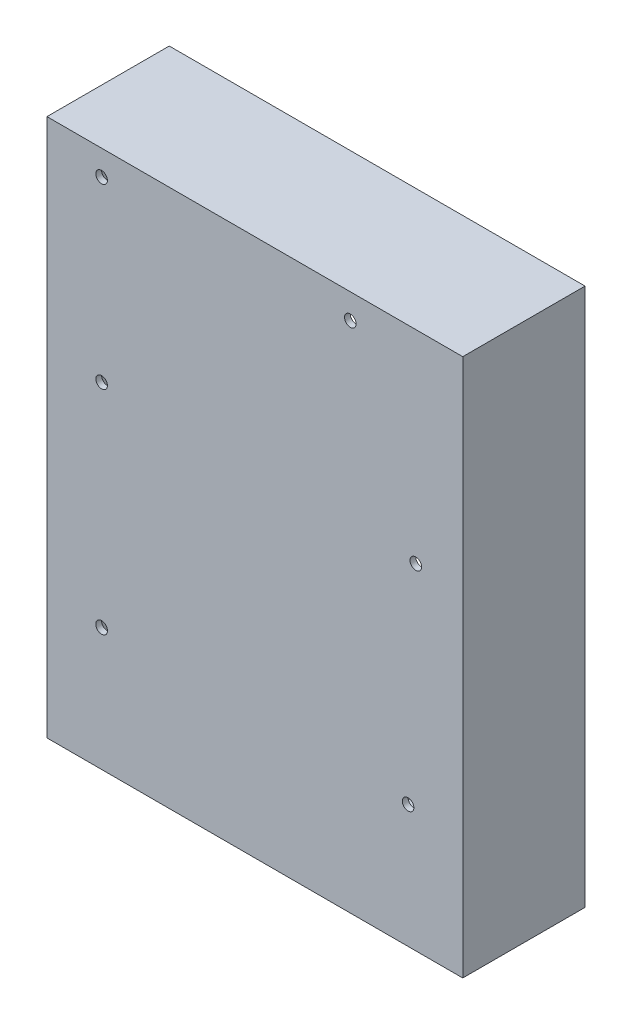
from build123d import *

# Parameters (mm, degrees)
SKETCH1_W           = 215.9
SKETCH1_H           = 279.4
BOSS_EXTRUDE1_DEPTH = 3
SKETCH2_W           = 215.9
SKETCH2_H           = 279.4
SKETCH2_W_2         = 209.9
SKETCH2_H_2         = 273.4
BOSS_EXTRUDE2_DEPTH = 63.5
SKETCH3_R           = 3
SKETCH3_R_2         = 3.05
CUT_EXTRUDE3_DEPTH  = 5


with BuildPart() as part:
    # Sketch1 → Boss-Extrude1 (new body)
    with BuildSketch(Plane.XY):
        with Locations((-11.047990366, 57.640345361)):
            Rectangle(SKETCH1_W, SKETCH1_H)
    extrude(amount=BOSS_EXTRUDE1_DEPTH)

    # Sketch2 → Boss-Extrude2 (add)
    with BuildSketch(Plane.XY.offset(3)):
        with Locations((-11.047990366, 57.640345361)):
            Rectangle(SKETCH2_W, SKETCH2_H)
        with Locations((-11.047990366, 57.640345361)):
            Rectangle(SKETCH2_W_2, SKETCH2_H_2, mode=Mode.SUBTRACT)
    extrude(amount=-BOSS_EXTRUDE2_DEPTH)

    # Sketch3 → Cut-Extrude3 (cut)
    with BuildSketch(Plane(origin=(0, 0, 0), x_dir=(-1, 0, 0), z_dir=(0, 0, -1))):
        with Locations((-68.517009634, -18.179654639)):
            Circle(SKETCH3_R)
        with Locations((-72.517009634, 92.080345361)):
            Circle(SKETCH3_R)
        with Locations((-38.517009634, 184.340345361)):
            Circle(SKETCH3_R)
        with Locations((90.612990366, 92.080345361)):
            Circle(SKETCH3_R)
        with Locations((-58.712009634, -93.094201664)):
            Circle(SKETCH3_R)
        with Locations((90.612990366, 184.340345361)):
            Circle(SKETCH3_R)
        with Locations((90.612990366, -18.179654639)):
            Circle(SKETCH3_R_2)
    extrude(amount=-CUT_EXTRUDE3_DEPTH, mode=Mode.SUBTRACT)


solid = part.part
